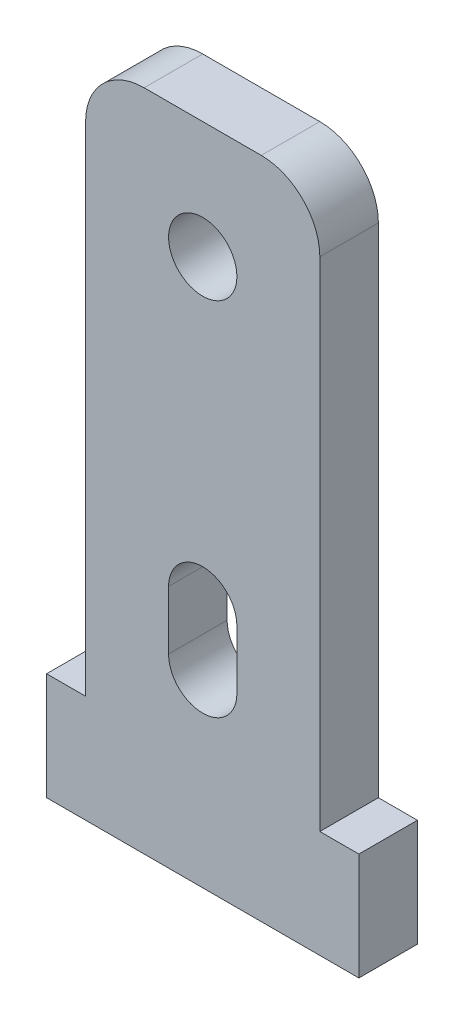
from build123d import *

# Parameters (mm, degrees)
SKETCH1_R           = 1.75
SKETCH1_W           = 16
SKETCH1_H           = 5.5
BOSS_EXTRUDE1_DEPTH = 3


with BuildPart() as part:
    # Sketch1 → Boss-Extrude1 (new body)
    # profile 1 of 2: a face of its own
    with BuildSketch(Plane.XY):
        with BuildLine():
            Line((-3, 18.5), (3, 18.5))
            ThreePointArc((3, 18.5), (5.121320344, 17.621320344), (6, 15.5))
            Line((6, 15.5), (6, -15.5))
            Line((6, -15.5), (-6, -15.5))
            Line((-6, -15.5), (-6, 15.5))
            ThreePointArc((-6, 15.5), (-5.121320344, 17.621320344), (-3, 18.5))
        make_face()
        with Locations((0, 12.5)):
            Circle(SKETCH1_R, mode=Mode.SUBTRACT)
        with BuildLine():
            Line((1.75, -3), (1.75, -6))
            ThreePointArc((1.75, -6), (0, -7.75), (-1.75, -6))
            Line((-1.75, -6), (-1.75, -3))
            ThreePointArc((-1.75, -3), (0, -1.25), (1.75, -3))
        make_face(mode=Mode.SUBTRACT)
    # profile 2 of 2: a face of its own
    with BuildSketch(Plane.XY):
        with Locations((0, -12.75)):
            Rectangle(SKETCH1_W, SKETCH1_H)
    extrude(amount=BOSS_EXTRUDE1_DEPTH)


solid = part.part
